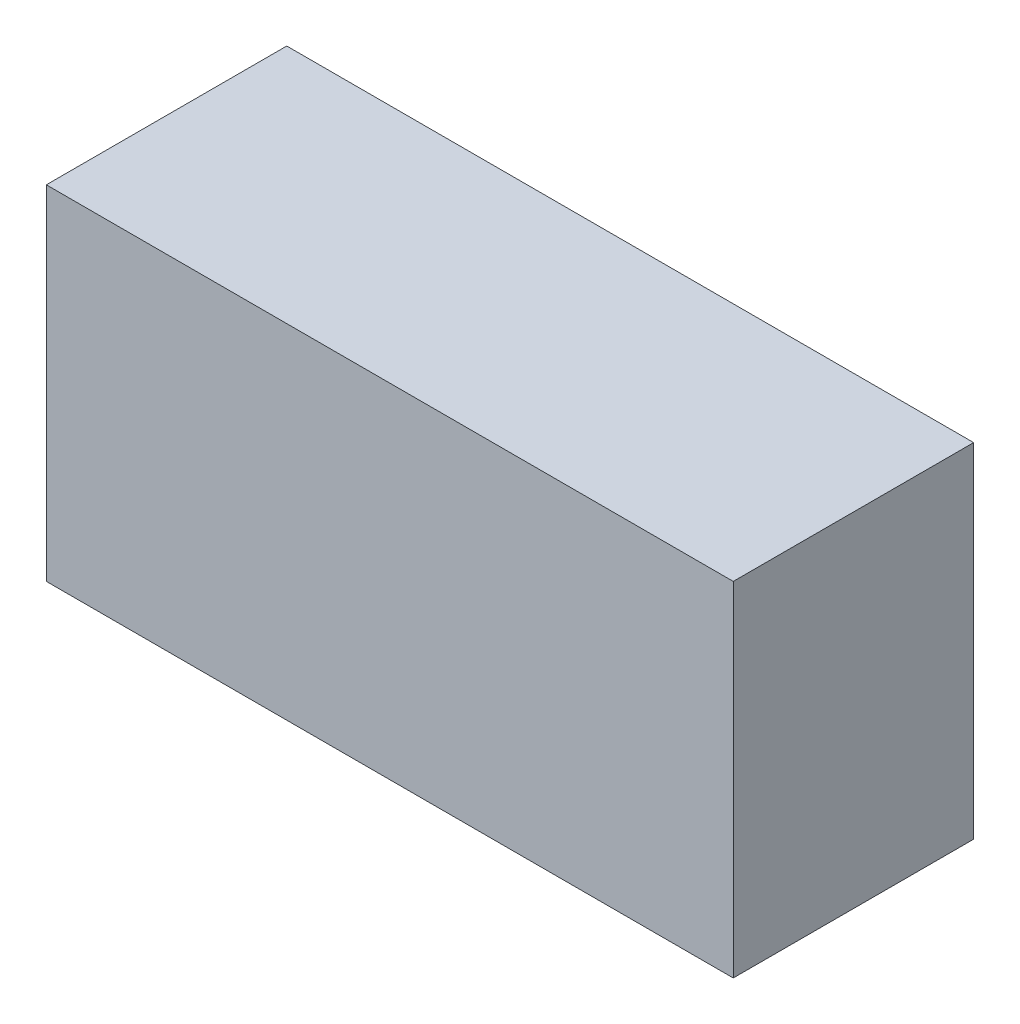
from build123d import *

# Parameters (mm, degrees)
SKETCH_1_W      = 200
SKETCH_1_H      = 100
EXTRUDE_1_DEPTH = 70
SKETCH_3_R      = 25
EXTRUDE_2_DEPTH = 20


with BuildPart() as part:
    # 草图1 → 凸台-拉伸1 (new body)
    with BuildSketch(Plane.XY):
        Rectangle(SKETCH_1_W, SKETCH_1_H)
    extrude(amount=EXTRUDE_1_DEPTH)

    # 草图3 → 凸台-拉伸2 (add)
    with BuildSketch(Plane(origin=(0, 0, 0), x_dir=(-1, 0, 0), z_dir=(0, 0, -1))):
        Circle(SKETCH_3_R)
    extrude(amount=EXTRUDE_2_DEPTH)


solid = part.part
